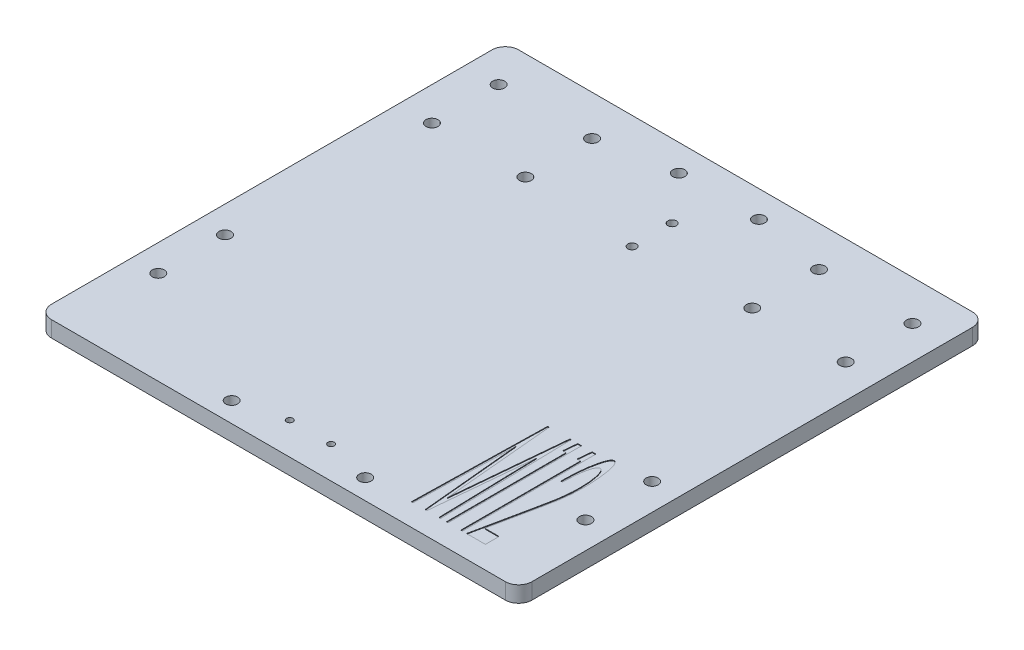
from build123d import *

# Parameters (mm, degrees)
SKETCH1_W                 = 180
SKETCH1_H                 = 175
PLATE_DEPTH               = 6
FILLET_CORNERS_R          = 5
SKETCH2_R                 = 2.25
MOTOR_BRACKET_HOLES_DEPTH = 126.667219274
SKETCH3_R                 = 1.2
CASTER_HOLES_DEPTH        = 126.667219274
SKETCH4_R                 = 2.25
ULTRASOUND_HOLES_DEPTH    = 126.667219274
SKETCH6_R                 = 2.25
BATTERY_CAGE_HOLES_DEPTH  = 126.667219274
SKETCH5_R                 = 2.25
FRONT_HOLES_DEPTH         = 126.667219274
TEAM_NAME_DEPTH           = 0.25
SKETCH8_R                 = 1.6
BEACON_HOLES_DEPTH        = 126.667219415


with BuildPart() as part:
    # Sketch1 → plate (new body)
    with BuildSketch(Plane(origin=(0, 0, 0), x_dir=(1, 0, 0), z_dir=(0, 1, 0))):
        Rectangle(SKETCH1_W, SKETCH1_H)
    extrude(amount=PLATE_DEPTH)

    # Fillet corners
    fillet_corners_edges = [part.edges().sort_by_distance(p)[0] for p in [
        (-90, 3, -87.5),
        (90, 3, -87.5),
        (90, 3, 87.5),
        (-90, 3, 87.5),
    ]]
    fillet(fillet_corners_edges, radius=FILLET_CORNERS_R)

    # Sketch2 → motor bracket holes (cut, through all)
    with BuildSketch(Plane(origin=(0, 6, 0), x_dir=(1, 0, 0), z_dir=(0, 1, 0))):
        with Locations(Location((-77.5, 72.5, 0), (0, 0, 270))):
            Circle(SKETCH2_R)
        with Locations(Location((-42.5, 72.5, 0), (0, 0, 270))):
            Circle(SKETCH2_R)
        with Locations(Location((-42.5, 47.5, 0), (0, 0, 270))):
            Circle(SKETCH2_R)
        with Locations(Location((-77.5, 47.5, 0), (0, 0, 270))):
            Circle(SKETCH2_R)
    motor_bracket_holes = extrude(amount=-MOTOR_BRACKET_HOLES_DEPTH, mode=Mode.SUBTRACT)

    # Sketch3 → caster holes (cut, through all)
    with BuildSketch(Plane(origin=(0, 6, 0), x_dir=(1, 0, 0), z_dir=(0, 1, 0))):
        with Locations(Location((-7.75, -75.5, 0), (0, 0, 270))):
            Circle(SKETCH3_R)
        with Locations(Location((7.75, -75.5, 0), (0, 0, 270))):
            Circle(SKETCH3_R)
    extrude(amount=-CASTER_HOLES_DEPTH, mode=Mode.SUBTRACT)

    # Sketch4 → ultrasound holes (cut, through all)
    with BuildSketch(Plane(origin=(0, 6, 0), x_dir=(1, 0, 0), z_dir=(0, 1, 0))):
        with Locations(Location((-80, -52.5, 0), (0, 0, 270))):
            Circle(SKETCH4_R)
        with Locations(Location((-80, -27.5, 0), (0, 0, 270))):
            Circle(SKETCH4_R)
    ultrasound_holes = extrude(amount=-ULTRASOUND_HOLES_DEPTH, mode=Mode.SUBTRACT)

    # Sketch6 → battery cage holes (cut, through all)
    with BuildSketch(Plane(origin=(0, 6, 0), x_dir=(1, 0, 0), z_dir=(0, 1, 0))):
        with Locations(Location((-25, -80, 0), (0, 0, 270))):
            Circle(SKETCH6_R)
    battery_cage_holes = extrude(amount=-BATTERY_CAGE_HOLES_DEPTH, mode=Mode.SUBTRACT)

    # Sketch5 → front holes (cut, through all)
    with BuildSketch(Plane(origin=(0, 6, 0), x_dir=(1, 0, 0), z_dir=(0, 1, 0))):
        with Locations(Location((-15, 77.5, 0), (0, 0, 270))):
            Circle(SKETCH5_R)
        with Locations(Location((15, 77.5, 0), (0, 0, 270))):
            Circle(SKETCH5_R)
    extrude(amount=-FRONT_HOLES_DEPTH, mode=Mode.SUBTRACT)

    # Mirror holes: motor bracket holes, ultrasound holes, battery cage holes across plane
    add(motor_bracket_holes.mirror(Plane(origin=(0, 0, 0), x_dir=(0, 0, 1), z_dir=(1, 0, 0))), mode=Mode.SUBTRACT)
    add(ultrasound_holes.mirror(Plane(origin=(0, 0, 0), x_dir=(0, 0, 1), z_dir=(1, 0, 0))), mode=Mode.SUBTRACT)
    add(battery_cage_holes.mirror(Plane(origin=(0, 0, 0), x_dir=(0, 0, 1), z_dir=(1, 0, 0))), mode=Mode.SUBTRACT)

    # Sketch7 → team name (cut)
    with BuildSketch(Plane(origin=(0, 6, 0), x_dir=(1, 0, 0), z_dir=(0, 1, 0))):
        Polygon((41.490517689, -79.14413255), (42.552216407, -29.14413255), (43.123129869, -29.14413255), (46.939235638, -71.061199858), (50.825453587, -29.14413255), (51.306222818, -29.14413255), (52.387953587, -79.14413255), (51.756943972, -79.14413255), (50.785389484, -41.694212678), (47.269764484, -79.14413255), (46.618722818, -79.14413255), (43.093081792, -41.64413255), (42.121527305, -79.14413255), align=None)
        Polygon((53.776174741, -29.14413255), (55.208466407, -29.14413255), (55.208466407, -79.14413255), (54.567440766, -79.14413255), (54.567440766, -34.272337678), (53.285389484, -34.272337678), align=None)
        Polygon((59.160790125, -29.14413255), (60.593081792, -29.14413255), (60.593081792, -79.14413255), (59.952056151, -79.14413255), (59.952056151, -34.272337678), (58.670004869, -34.272337678), align=None)
        with BuildLine():
            Line((63.413594613, -44.528747935), (62.772568972, -44.528747935))
            add(Edge.make_bspline(
                [(62.772568972, -44.528747935), (62.781493316, -43.93445176), (62.798943386, -42.772404539), (62.842798919, -41.072258174), (62.935478667, -39.452750644), (63.05750017, -37.917150742), (63.19141105, -36.456345848), (63.373095419, -35.080629373), (63.581991977, -33.784289246), (63.820632002, -32.581935586), (64.074552978, -31.491828406), (64.344756451, -30.540110197), (64.61215525, -29.731836807), (64.884672979, -29.067522721), (65.17629041, -28.549168463), (65.459482684, -28.166880995), (65.766362376, -27.911333409), (65.994533796, -27.877435937), (66.097889484, -27.862081268)],
                knots=[0, 0, 0, 0, 1.632956762, 3.192975066, 4.67207115, 6.088935359, 7.425149098, 8.701691951, 9.900535109, 11.032042853, 12.068832046, 12.974740653, 13.7492155, 14.406834829, 14.944978755, 15.376189076, 15.717429958, 16, 16, 16, 16], degree=3))
            add(Edge.make_bspline(
                [(66.097889484, -27.862081268), (66.214593659, -27.876513312), (66.459978019, -27.906858394), (66.789228182, -28.148258945), (67.095157034, -28.504713995), (67.376289014, -29.00124848), (67.646270357, -29.629255057), (67.889389184, -30.396480918), (68.13076794, -31.297967968), (68.422485253, -32.715843502), (68.730325215, -34.671525798), (68.998284034, -37.188458627), (69.158674349, -39.905916797), (69.174590453, -41.784130898), (69.182825382, -42.755911396)],
                knots=[0, 0, 0, 0, 0.265111354, 0.557428048, 0.903723158, 1.338574996, 1.855033468, 2.4660581, 3.177426512, 3.989273206, 5.775956304, 7.703955125, 9.777243485, 12, 12, 12, 12], degree=3))
            add(Edge.make_bspline(
                [(69.182825382, -42.755911396), (69.174478109, -43.45049961), (69.15801384, -44.820514374), (69.047340862, -46.842189249), (68.862186477, -48.797931916), (68.622075004, -50.396898082), (68.411616198, -51.695290325), (68.214396392, -52.741857038), (68.009797757, -53.872058653), (67.763428304, -55.085556549), (67.507271104, -56.381810617), (67.222599468, -57.759829632), (66.926861643, -59.220525286), (66.710071993, -60.220774042), (66.598690766, -60.734677422)],
                knots=[0, 0, 0, 0, 1.373593798, 2.709294146, 4.002897475, 5.256921411, 5.906027412, 6.604062607, 7.36293037, 8.177408102, 9.052743955, 9.975998375, 10.960117401, 12, 12, 12, 12], degree=3))
            Line((66.598690766, -60.734677422), (63.834267689, -74.015927422))
            Line((63.834267689, -74.015927422), (69.182825382, -74.015927422))
            Line((69.182825382, -74.015927422), (69.182825382, -79.14413255))
            Line((69.182825382, -79.14413255), (62.13154333, -79.14413255))
            Line((62.13154333, -79.14413255), (66.438434356, -58.451023576))
            add(Edge.make_bspline(
                [(66.438434356, -58.451023576), (66.541275625, -57.956765987), (66.740022638, -57.001583104), (67.038126467, -55.62227416), (67.281204083, -54.337396726), (67.517596013, -53.153963402), (67.714834282, -52.068252304), (67.888303774, -51.080497667), (68.028581018, -50.192251945), (68.246517983, -48.62036821), (68.489685546, -46.278314551), (68.524176548, -44.192336007), (68.541799741, -43.126504345)],
                knots=[0, 0, 0, 0, 0.977048528, 1.888205767, 2.730899807, 3.507700373, 4.223757048, 4.86643668, 5.448577838, 5.963957604, 7.937782349, 10, 10, 10, 10], degree=3))
            add(Edge.make_bspline(
                [(68.541799741, -43.126504345), (68.536927467, -42.458412904), (68.527536358, -41.170693779), (68.377133023, -39.312911942), (68.172341189, -37.593632449), (67.892830311, -36.269968348), (67.657192593, -35.307097273), (67.453256742, -34.701856907), (67.260548337, -34.179683247), (67.036846336, -33.761564083), (66.823881555, -33.42188765), (66.588014894, -33.178683952), (66.333600869, -33.026029048), (66.152915281, -33.001728194), (66.067841407, -32.990286396)],
                knots=[0, 0, 0, 0, 2.216081534, 4.27140717, 6.18139161, 7.956427784, 8.757128989, 9.468293711, 10.075172411, 10.600423608, 11.039796501, 11.400135884, 11.717560408, 12, 12, 12, 12], degree=3))
            add(Edge.make_bspline(
                [(66.067841407, -32.990286396), (65.976155684, -33.00133342), (65.785870557, -33.024260481), (65.514038504, -33.177258474), (65.276430893, -33.434342115), (65.034037095, -33.763688283), (64.817075996, -34.1957923), (64.608254954, -34.718950361), (64.4125659, -35.339425303), (64.222521115, -36.047247528), (64.054411991, -36.839902752), (63.905399587, -37.712091101), (63.776129767, -38.660944953), (63.670442917, -39.686954193), (63.563011117, -40.787882759), (63.503471574, -41.967808104), (63.434232438, -43.222631631), (63.420612628, -44.084595296), (63.413594613, -44.528747935)],
                knots=[0, 0, 0, 0, 0.357691352, 0.74235488, 1.184483885, 1.716016461, 2.333635849, 3.0641575, 3.912772014, 4.870186639, 5.9228254, 7.072838979, 8.321875155, 9.658267009, 11.097074475, 12.63688611, 14.267054667, 16, 16, 16, 16], degree=3))
        make_face()
    extrude(amount=-TEAM_NAME_DEPTH, mode=Mode.SUBTRACT)

    # Sketch8 → beacon holes (cut, through all)
    with BuildSketch(Plane(origin=(0, 6, 0), x_dir=(1, 0, 0), z_dir=(0, 1, 0))):
        with Locations(Location((0, 45, 0), (0, 0, 270))):
            Circle(SKETCH8_R)
        with Locations(Location((0, 60, 0), (0, 0, 270))):
            Circle(SKETCH8_R)
    extrude(amount=-BEACON_HOLES_DEPTH, mode=Mode.SUBTRACT)


solid = part.part
